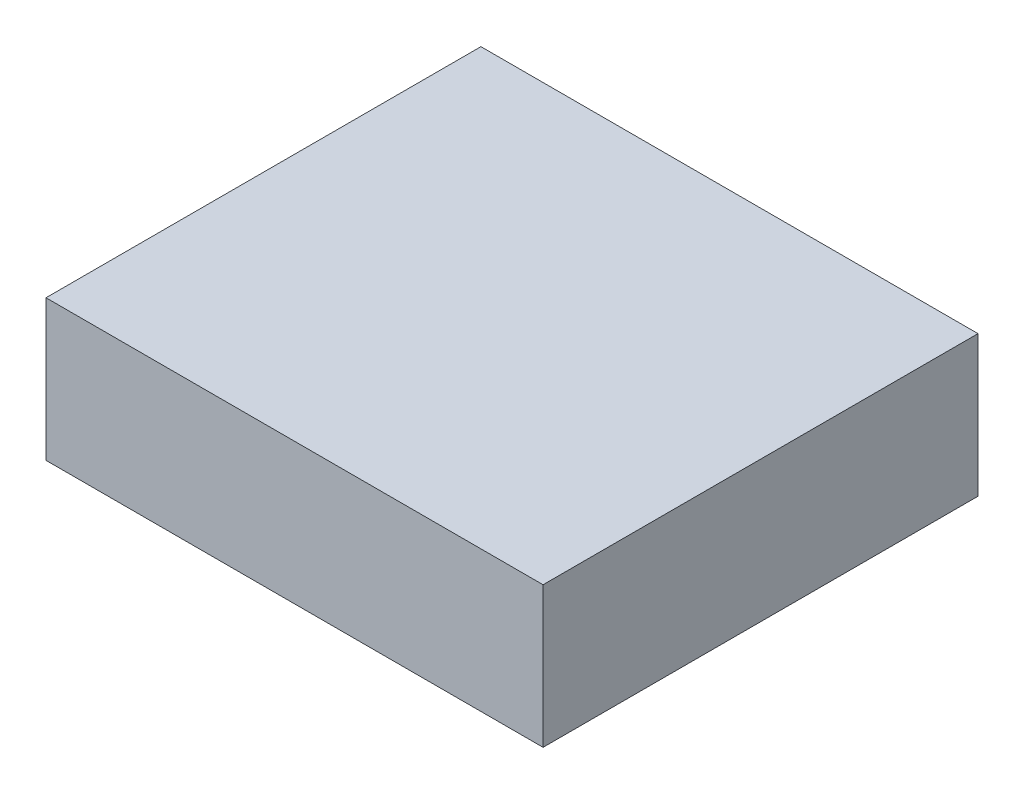
from build123d import *

# Parameters (mm, degrees)
SKETCH1_W           = 48
SKETCH1_H           = 42
BOSS_EXTRUDE1_DEPTH = 13.6


with BuildPart() as part:
    # Sketch1 → Boss-Extrude1 (new body)
    with BuildSketch(Plane(origin=(0, 0, 0), x_dir=(1, 0, 0), z_dir=(0, 1, 0))):
        Rectangle(SKETCH1_W, SKETCH1_H)
    extrude(amount=BOSS_EXTRUDE1_DEPTH)


solid = part.part
